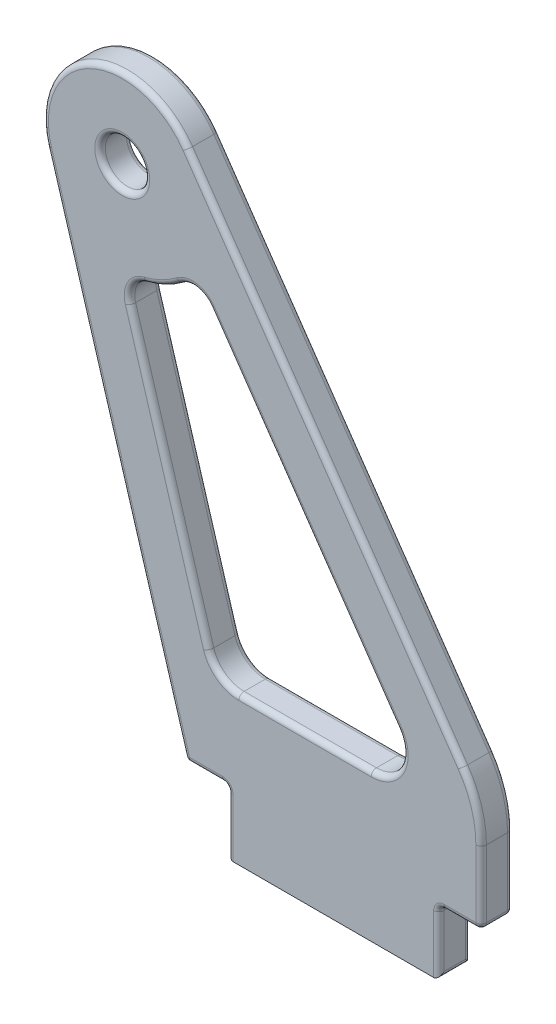
from build123d import *

# Parameters (mm, degrees)
SKETCH1_R           = 2.1
BOSS_EXTRUDE1_DEPTH = 3
CUT_EXTRUDE1_DEPTH  = 30.5
FILLET1_R           = 10
FILLET2_R           = 0.5


with BuildPart() as part:
    # Sketch1 → Boss-Extrude1 (new body)
    with BuildSketch(Plane.XY):
        with BuildLine():
            Line((-10, 0), (10, 0))
            Line((10, 0), (10, 6))
            Line((10, 6), (14, 6))
            Line((14, 6), (14, 16))
            Line((14, 16), (-13.83033124, 56.264409384))
            ThreePointArc((-13.83033124, 56.264409384), (-23.251693945, 58.758438169), (-27.182332689, 49.84034791))
            Line((-27.182332689, 49.84034791), (-14, 6))
            Line((-14, 6), (-10, 6))
            Line((-10, 6), (-10, 0))
        make_face()
        with Locations((-20, 52)):
            Circle(SKETCH1_R, mode=Mode.SUBTRACT)
    extrude(amount=BOSS_EXTRUDE1_DEPTH)

    # Sketch2 → Cut-Extrude1 (cut)
    with BuildSketch(Plane.XY.offset(3)):
        with BuildLine():
            Line((-8.95375269, 14), (3.583815293, 14))
            ThreePointArc((3.583815293, 14), (6.24062647, 15.606675067), (6.051682797, 18.705763754))
            Line((6.051682797, 18.705763754), (-11.695441217, 44.381975097))
            ThreePointArc((-11.695441217, 44.381975097), (-13.026246666, 45.21992654), (-14.551470543, 44.836653941))
            ThreePointArc((-14.551470543, 44.836653941), (-16.097967266, 43.889874197), (-17.802859732, 43.272309891))
            ThreePointArc((-17.802859732, 43.272309891), (-19.054162405, 42.319709563), (-19.229895057, 40.756915976))
            Line((-19.229895057, 40.756915976), (-11.826685765, 16.136139164))
            ThreePointArc((-11.826685765, 16.136139164), (-10.743783065, 14.592555036), (-8.95375269, 14))
        make_face()
    extrude(amount=-CUT_EXTRUDE1_DEPTH, mode=Mode.SUBTRACT)

    # Fillet1
    fillet1_edges = [part.edges().sort_by_distance(p)[0] for p in [
        (14, 16, 1.5),
    ]]
    fillet(fillet1_edges, radius=FILLET1_R)

    # Fillet2
    fillet2_edges = [part.edges().sort_by_distance(p)[0] for p in [
        (-12, 6, 3),
        (-10, 3, 0),
        (-12, 6, 0),
        (-20.591166344, 27.920173955, 0),
        (-23.251693945, 58.758438169, 0),
        (-10, 3, 3),
        (14, 6, 1.5),
        (10, 6, 1.5),
        (10, 0, 1.5),
        (-10, 0, 1.5),
        (-10, 6, 1.5),
        (-14, 6, 1.5),
        (10, 3, 3),
        (12, 6, 3),
        (-22.1, 52, 0),
        (-22.1, 52, 3),
        (14, 9.440192861, 3),
        (-16.097967266, 43.889874197, 0),
        (-19.054162405, 42.319709563, 0),
        (-15.528290411, 28.44652757, 0),
        (-10.743783065, 14.592555036, 0),
        (-2.684968699, 14, 0),
        (6.24062647, 15.606675067, 0),
        (-2.82187921, 31.543869425, 0),
        (-13.026246666, 45.21992654, 0),
        (-23.251693945, 58.758438169, 3),
        (-13.026246666, 45.21992654, 3),
        (-16.097967266, 43.889874197, 3),
        (-19.054162405, 42.319709563, 3),
        (-15.528290411, 28.44652757, 3),
        (-10.743783065, 14.592555036, 3),
        (-2.684968699, 14, 3),
        (6.24062647, 15.606675067, 3),
        (-2.82187921, 31.543869425, 3),
        (-0.802053114, 37.415337142, 0),
        (-0.802053114, 37.415337142, 3),
        (13.546262361, 15.858451358, 0),
        (-20.591166344, 27.920173955, 3),
        (13.546262361, 15.858451358, 3),
        (14, 9.440192861, 0),
        (12, 6, 0),
        (10, 3, 0),
    ]]
    fillet(fillet2_edges, radius=FILLET2_R)


solid = part.part
